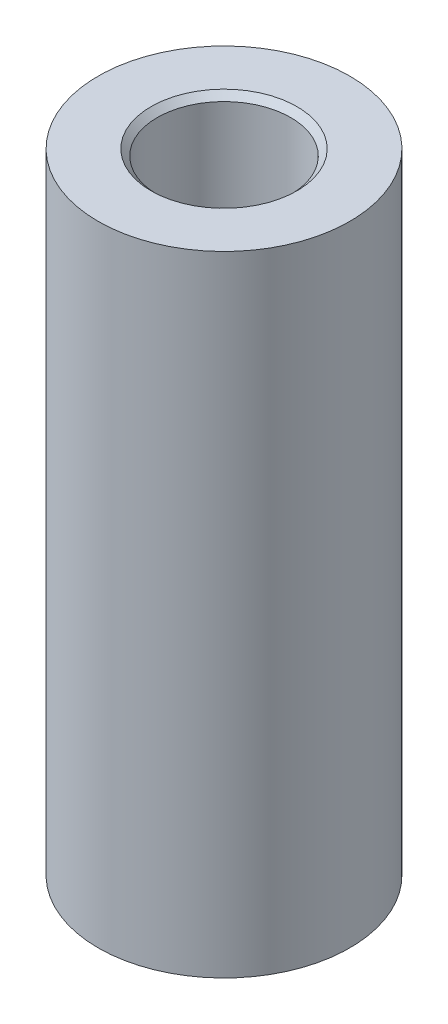
from build123d import *

# Parameters (mm, degrees)
SKETCH1_R            = 5
BOSS_EXTRUDE1_DEPTH  = 12.5
M5_CLEARANCE_HOLE1_D = 5.3
CHAMFER1_SIZE        = 0.25


with BuildPart() as part:
    # Sketch1 → Boss-Extrude1 (new, symmetric)
    with BuildSketch(Plane(origin=(0, 0, 0), x_dir=(1, 0, 0), z_dir=(0, 1, 0))):
        with Locations(Location((0, 0, 0), (0, 0, 270))):
            Circle(SKETCH1_R)
    extrude(amount=BOSS_EXTRUDE1_DEPTH, both=True)

    # M5 Clearance Hole1 (through all)
    with Locations(Plane(origin=(0, 12.5, 0), x_dir=(1, 0, 0), z_dir=(0, 1, 0))):
        with Locations((0, 0)):
            Hole(M5_CLEARANCE_HOLE1_D / 2)

    # Chamfer1
    chamfer1_edges = [part.edges().sort_by_distance(p)[0] for p in [
        (2.65, 12.5, 0),
        (2.65, -12.5, 0),
    ]]
    chamfer(chamfer1_edges, length=CHAMFER1_SIZE)


solid = part.part
